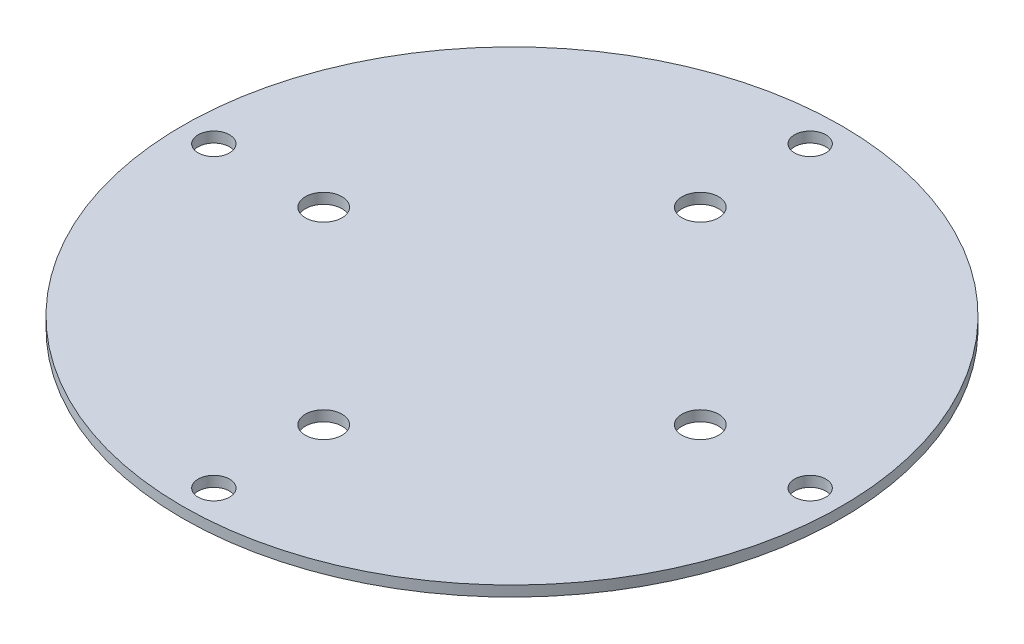
from build123d import *

# Parameters (mm, degrees)
SKETCH1_R           = 31.5
SKETCH1_R_2         = 1.75
SKETCH1_R_3         = 1.5
BOSS_EXTRUDE1_DEPTH = 1


with BuildPart() as part:
    # Sketch1 → Boss-Extrude1 (new body)
    with BuildSketch(Plane(origin=(0, 0, 0), x_dir=(1, 0, 0), z_dir=(0, 1, 0))):
        with Locations(Location((0, 0, 0), (0, 0, 270))):
            Circle(SKETCH1_R)
        with Locations(Location((-18, 0, 0), (0, 0, 270))):
            Circle(SKETCH1_R_2, mode=Mode.SUBTRACT)
        with Locations(Location((0, 18, 0), (0, 0, 270))):
            Circle(SKETCH1_R_2, mode=Mode.SUBTRACT)
        with Locations(Location((18, 0, 0), (0, 0, 270))):
            Circle(SKETCH1_R_2, mode=Mode.SUBTRACT)
        with Locations(Location((0, -18, 0), (0, 0, 270))):
            Circle(SKETCH1_R_2, mode=Mode.SUBTRACT)
        with Locations(Location((28.5, 0, 0), (0, 0, 270))):
            Circle(SKETCH1_R_3, mode=Mode.SUBTRACT)
        with Locations(Location((0, -28.5, 0), (0, 0, 270))):
            Circle(SKETCH1_R_3, mode=Mode.SUBTRACT)
        with Locations(Location((-28.5, 0, 0), (0, 0, 270))):
            Circle(SKETCH1_R_3, mode=Mode.SUBTRACT)
        with Locations(Location((0, 28.5, 0), (0, 0, 270))):
            Circle(SKETCH1_R_3, mode=Mode.SUBTRACT)
    extrude(amount=BOSS_EXTRUDE1_DEPTH)


solid = part.part
